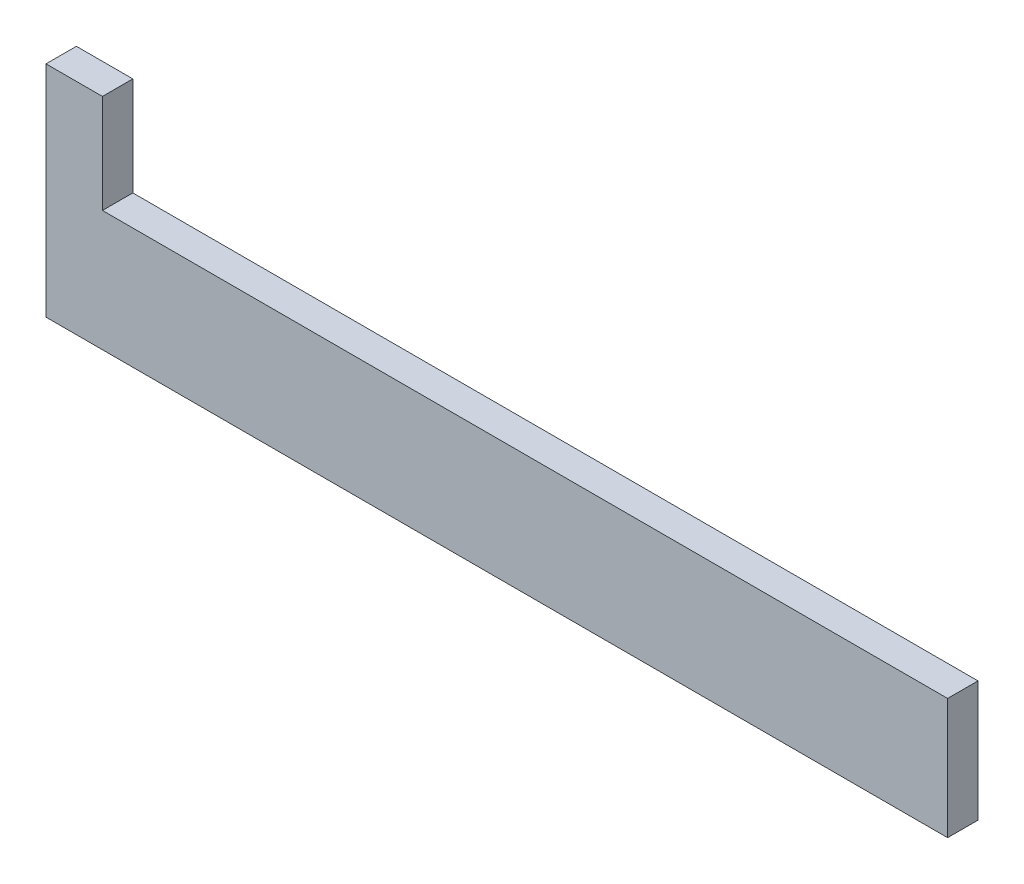
from build123d import *

# Parameters (mm, degrees)
BOSS_EXTRUDE1_DEPTH = 2.1536931
CUT_EXTRUDE1_REACH  = 56.318
SKETCH3_W           = 2.1536931
SKETCH3_H           = 7
SKETCH4_W           = 2.1536931
SKETCH4_H           = 8.5489795
BOSS_EXTRUDE2_DEPTH = 7.9


with BuildPart() as part:
    # Sketch1 → Boss-Extrude1 (new body)
    with BuildSketch(Plane.XY):
        Polygon((28, 0), (-28, 0), (-28, 15.5489795), (-24, 15.5489795), (-24, 8.5489795), (24, 8.5489795), (24, 15.5489795), (28, 15.5489795), align=None)
    extrude(amount=BOSS_EXTRUDE1_DEPTH)

    # Sketch3 → Cut-Extrude1 (cut, up to next)
    with BuildSketch(Plane.ZY.offset(-24), mode=Mode.PRIVATE) as cut_extrude1_sk1:
        with Locations((1.07684655, 12.0489795)):
            Rectangle(SKETCH3_W, SKETCH3_H)
    cut_extrude1_tool1 = extrude(cut_extrude1_sk1.sketch, amount=-CUT_EXTRUDE1_REACH, mode=Mode.PRIVATE) & part.part
    add(cut_extrude1_tool1.solids().sort_by_distance((24, 12.048979, 1.076847))[0], mode=Mode.SUBTRACT)

    # Sketch4 → Boss-Extrude2 (add)
    with BuildSketch(Plane(origin=(28, 0, 0), x_dir=(0, 0, -1), z_dir=(1, 0, 0))):
        with Locations((-1.07684655, 4.27448975)):
            Rectangle(SKETCH4_W, SKETCH4_H)
    extrude(amount=BOSS_EXTRUDE2_DEPTH)


solid = part.part
